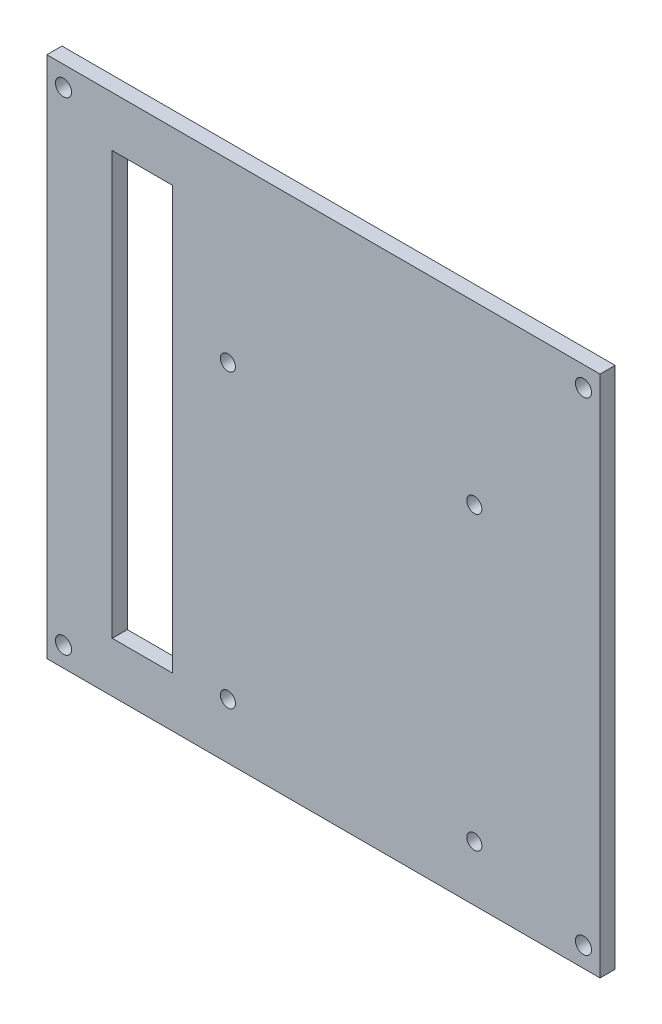
from build123d import *

# Parameters (mm, degrees)
CROQUIS1_W                   = 110
CROQUIS1_H                   = 92
SALIENTE_EXTRUIR1_DEPTH      = 3
CROQUIS7_W                   = 110
CROQUIS7_H                   = 3
SALIENTE_EXTRUIR2_DEPTH      = 6
CROQUIS8_W                   = 110
CROQUIS8_H                   = 3
SALIENTE_EXTRUIR3_DEPTH      = 6
TALADRO_DE_MARGEN_PARA_M31_D = 3.2
CORTAR_EXTRUIR2_REACH        = 142.901
CROQUIS13_R                  = 1.5
CORTAR_EXTRUIR3_REACH        = 142.901
CROQUIS14_W                  = 12
CROQUIS14_H                  = 84


with BuildPart() as part:
    # Croquis1 → Saliente-Extruir1 (new body)
    with BuildSketch(Plane.XY):
        with Locations((55, 36)):
            Rectangle(CROQUIS1_W, CROQUIS1_H)
    extrude(amount=SALIENTE_EXTRUIR1_DEPTH)

    # Croquis7 → Saliente-Extruir2 (add)
    with BuildSketch(Plane(origin=(0, 82, 0), x_dir=(1, 0, 0), z_dir=(0, 1, 0))):
        with Locations((55, -1.5)):
            Rectangle(CROQUIS7_W, CROQUIS7_H)
    extrude(amount=SALIENTE_EXTRUIR2_DEPTH)

    # Croquis8 → Saliente-Extruir3 (add)
    with BuildSketch(Plane.XZ.offset(10)):
        with Locations((55, 1.5)):
            Rectangle(CROQUIS8_W, CROQUIS8_H)
    extrude(amount=SALIENTE_EXTRUIR3_DEPTH)

    # Taladro de margen para M31 (through all)
    with Locations(Plane(origin=(3.3, 84, 3), x_dir=(1, 0, 0), z_dir=(0, 0, 1))):
        with Locations((0, 0), (0, -96), (103.4, -96), (103.4, 0)):
            Hole(TALADRO_DE_MARGEN_PARA_M31_D / 2)

    # Croquis13 → Cortar-Extruir2 (cut, up to next)
    with BuildSketch(Plane.XY.offset(3), mode=Mode.PRIVATE) as cortar_extruir2_sk1:
        with Locations((36, 53)):
            Circle(CROQUIS13_R)
    cortar_extruir2_tool1 = extrude(cortar_extruir2_sk1.sketch, amount=-CORTAR_EXTRUIR2_REACH, mode=Mode.PRIVATE) & part.part
    # Croquis13 → Cortar-Extruir2 (cut, up to next)
    with BuildSketch(Plane.XY.offset(3), mode=Mode.PRIVATE) as cortar_extruir2_sk2:
        with Locations((85, 53)):
            Circle(CROQUIS13_R)
    cortar_extruir2_tool2 = extrude(cortar_extruir2_sk2.sketch, amount=-CORTAR_EXTRUIR2_REACH, mode=Mode.PRIVATE) & part.part
    # Croquis13 → Cortar-Extruir2 (cut, up to next)
    with BuildSketch(Plane.XY.offset(3), mode=Mode.PRIVATE) as cortar_extruir2_sk3:
        with Locations((36, -5)):
            Circle(CROQUIS13_R)
    cortar_extruir2_tool3 = extrude(cortar_extruir2_sk3.sketch, amount=-CORTAR_EXTRUIR2_REACH, mode=Mode.PRIVATE) & part.part
    # Croquis13 → Cortar-Extruir2 (cut, up to next)
    with BuildSketch(Plane.XY.offset(3), mode=Mode.PRIVATE) as cortar_extruir2_sk4:
        with Locations((85, -5)):
            Circle(CROQUIS13_R)
    cortar_extruir2_tool4 = extrude(cortar_extruir2_sk4.sketch, amount=-CORTAR_EXTRUIR2_REACH, mode=Mode.PRIVATE) & part.part
    add(cortar_extruir2_tool1.solids().sort_by_distance((36, 53, 3))[0], mode=Mode.SUBTRACT)
    add(cortar_extruir2_tool2.solids().sort_by_distance((85, 53, 3))[0], mode=Mode.SUBTRACT)
    add(cortar_extruir2_tool3.solids().sort_by_distance((36, -5, 3))[0], mode=Mode.SUBTRACT)
    add(cortar_extruir2_tool4.solids().sort_by_distance((85, -5, 3))[0], mode=Mode.SUBTRACT)

    # Croquis14 → Cortar-Extruir3 (cut, up to next)
    with BuildSketch(Plane.XY.offset(3), mode=Mode.PRIVATE) as cortar_extruir3_sk1:
        with Locations((19, 36)):
            Rectangle(CROQUIS14_W, CROQUIS14_H)
    cortar_extruir3_tool1 = extrude(cortar_extruir3_sk1.sketch, amount=-CORTAR_EXTRUIR3_REACH, mode=Mode.PRIVATE) & part.part
    add(cortar_extruir3_tool1.solids().sort_by_distance((19, 36, 3))[0], mode=Mode.SUBTRACT)


solid = part.part
